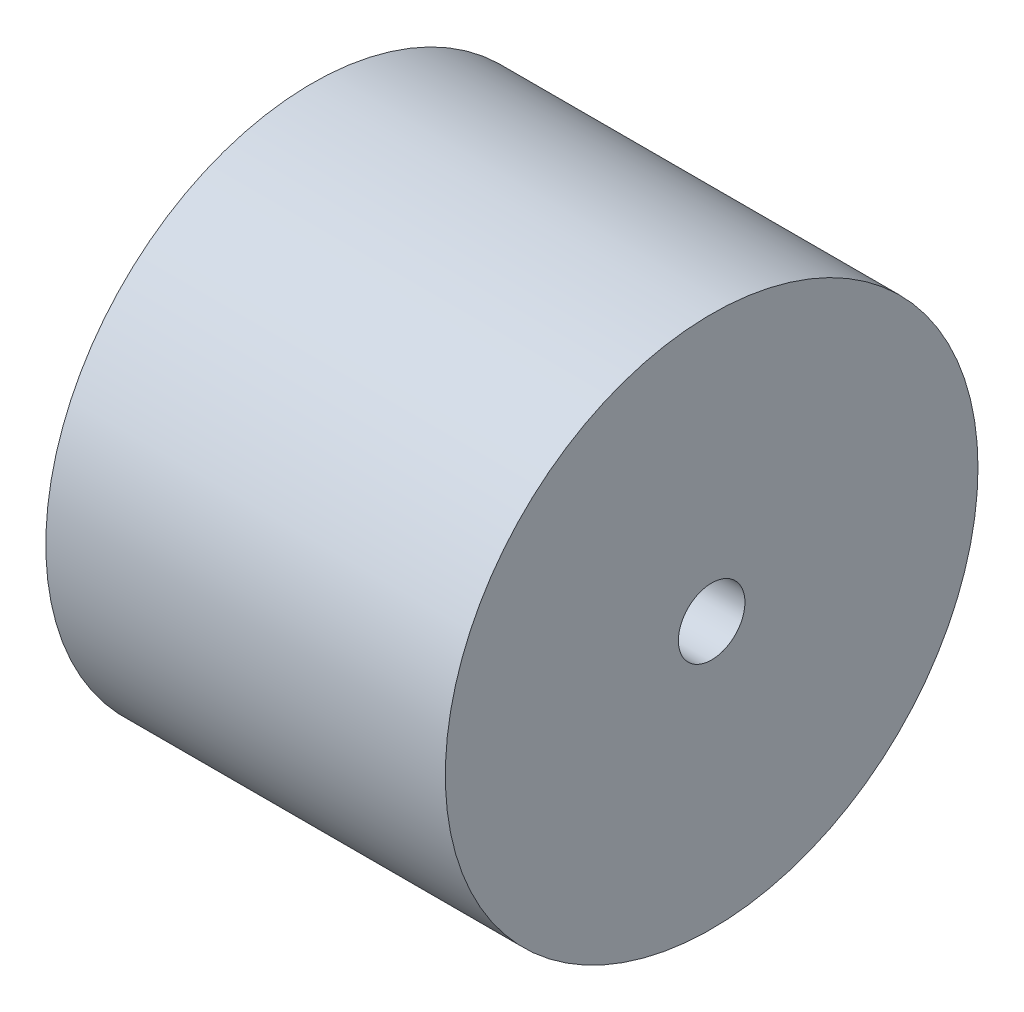
from build123d import *

# Parameters (mm, degrees)
M3_TAPPED_HOLE1_D     = 2.5
M3_TAPPED_HOLE1_DEPTH = 7.5
M3_TAPPED_HOLE1_TIP   = 0.751075774


with BuildPart() as part:
    # Sketch1 → Revolve1 (revolve)
    with BuildSketch(Plane.XY, mode=Mode.PRIVATE) as revolve1_sk:
        with BuildLine():
            Line((0, 0), (0, 10))
            Line((0, 10), (-15, 10))
            Line((-15, 10), (-15, 8.5))
            ThreePointArc((-15, 8.5), (-14.465142775, 6.25), (-15, 4))
            Line((-15, 4), (-15, 0))
            Line((-15, 0), (0, 0))
        make_face()
    revolve(revolve1_sk.sketch.rotate(Axis((0, 0, 0), (-1, 0, 0)), 90), axis=Axis((0, 0, 0), (-1, 0, 0)))

    # M3 Tapped Hole1
    with Locations(Plane(origin=(0, 0, 0), x_dir=(0, 0, -1), z_dir=(1, 0, 0))):
        with Locations((0, 0)):
            Hole(M3_TAPPED_HOLE1_D / 2, depth=M3_TAPPED_HOLE1_DEPTH)
            with Locations((0, 0, -(M3_TAPPED_HOLE1_DEPTH + M3_TAPPED_HOLE1_TIP / 2))):  # 118° drill point
                Cone(0, M3_TAPPED_HOLE1_D / 2, M3_TAPPED_HOLE1_TIP, mode=Mode.SUBTRACT)


solid = part.part
